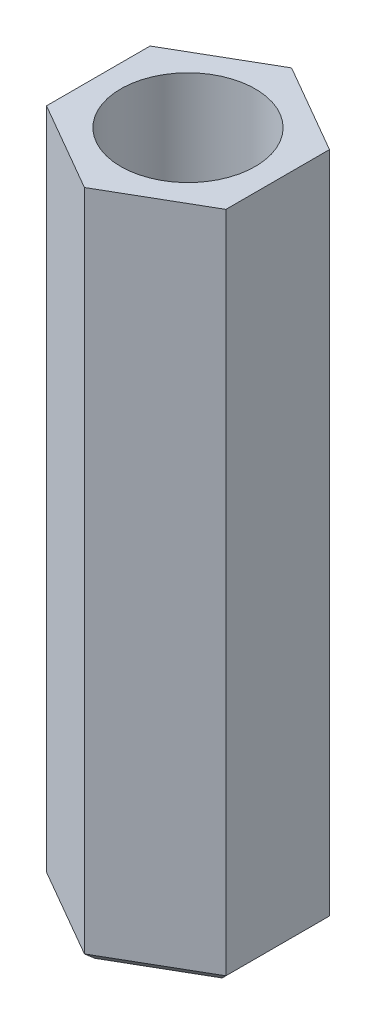
from build123d import *

# Parameters (mm, degrees)
ESQUISSE1_R        = 1.5
BOSS_EXTRU_1_DEPTH = 15
CHANFREIN1_SIZE    = 0.2


with BuildPart() as part:
    # Esquisse1 → Boss.-Extru.1 (new body)
    with BuildSketch(Plane(origin=(0, 0, 0), x_dir=(1, 0, 0), z_dir=(0, 1, 0))):
        Polygon((0, -2.309401077), (2, -1.154700538), (2, 1.154700538), (0, 2.309401077), (-2, 1.154700538), (-2, -1.154700538), align=None)
        with Locations(Location((0, 0, 0), (0, 0, 270))):
            Circle(ESQUISSE1_R, mode=Mode.SUBTRACT)
    extrude(amount=BOSS_EXTRU_1_DEPTH)

    # Chanfrein1
    chanfrein1_edges = [part.edges().sort_by_distance(p)[0] for p in [
        (0, 0, -1.5),
        (-2, 0, 0),
        (-1, 0, -1.732050808),
        (1, 0, -1.732050808),
        (2, 0, 0),
        (1, 0, 1.732050808),
        (-1, 0, 1.732050808),
    ]]
    chamfer(chanfrein1_edges, length=CHANFREIN1_SIZE)


solid = part.part
